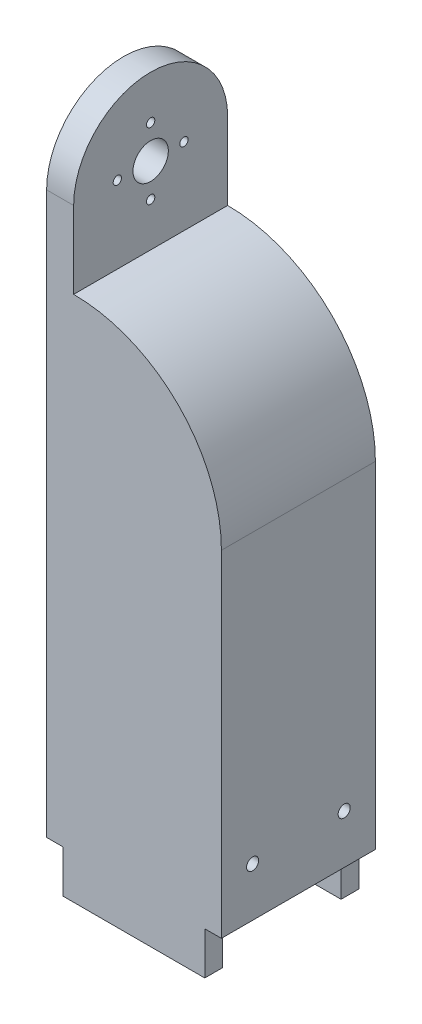
from build123d import *

# Parameters (mm, degrees)
SKETCH1_W               = 50
SKETCH1_H               = 150
BOSS_EXTRUDE1_DEPTH     = 55
CUT_EXTRUDE1_DEPTH      = 168.406690428
CUT_EXTRUDE1_DEPTH_BACK = 45
SKETCH2_R               = 10.25
SKETCH7_R               = 1
SKETCH7_R_2             = 4.25
CUT_EXTRUDE3_DEPTH      = 10
SKETCH8_W               = 55
SKETCH8_H               = 55
SKETCH8_R               = 10.25
BOSS_EXTRUDE2_DEPTH     = 50
SKETCH10_W              = 8
SKETCH10_H              = 10.25
SKETCH10_W_2            = 17
SKETCH10_H_2            = 1
SKETCH10_W_3            = 34
SKETCH10_H_3            = 20
SKETCH10_H_4            = 5
CUT_EXTRUDE4_DEPTH      = 214.717102732
SKETCH11_W              = 34
SKETCH11_H              = 13.25
BOSS_EXTRUDE4_DEPTH     = 25
SKETCH13_W              = 55
SKETCH13_H              = 10
CUT_EXTRUDE5_DEPTH      = 8
SKETCH14_R              = 5.030159043
CUT_EXTRUDE6_DEPTH      = 8
SKETCH15_W              = 34
SKETCH15_H              = 0.25
BOSS_EXTRUDE5_DEPTH     = 13.25
CUT_EXTRUDE7_DEPTH      = 181.416185527
BOSS_EXTRUDE6_START     = 1.5
SKETCH19_R              = 10.25
SKETCH19_R_2            = 1
SKETCH19_R_3            = 4.25
BOSS_EXTRUDE6_DEPTH     = 1.5
CUT_EXTRUDE8_DEPTH      = 184.89467094
SKETCH21_R              = 5.030159043
SKETCH21_R_2            = 4.5
BOSS_EXTRUDE7_DEPTH     = 8
SKETCH24_W              = 4
SKETCH24_H              = 30
CUT_EXTRUDE10_DEPTH     = 181.416185527
SKETCH25_W              = 55
SKETCH25_H              = 86.25
CUT_EXTRUDE11_DEPTH     = 4
BOSS_EXTRUDE8_START     = 4
SKETCH26_R              = 1
SKETCH26_R_2            = 4.25
BOSS_EXTRUDE8_DEPTH     = 4
SKETCH27_W              = 4
SKETCH27_H              = 123.25
CUT_EXTRUDE12_DEPTH     = 181.416185527
CUT_EXTRUDE13_DEPTH     = 180.905530765
SKETCH29_W              = 42
SKETCH29_H              = 9
CUT_EXTRUDE15_DEPTH     = 174.776436838
SKETCH30_R              = 4.5
SKETCH30_R_2            = 1.45
BOSS_EXTRUDE9_DEPTH     = 4


with BuildPart() as part:
    # Sketch1 → Boss-Extrude1 (new body)
    with BuildSketch(Plane.XY):
        with Locations((0, -75)):
            Rectangle(SKETCH1_W, SKETCH1_H)
    extrude(amount=-BOSS_EXTRUDE1_DEPTH)

    # Sketch2 → Cut-Extrude1 (cut, two sides: drawn at the far end of the back side and taken through both)
    with BuildSketch(Plane(origin=(25, 0, 0), x_dir=(0, 0, -1), z_dir=(1, 0, 0)).offset(-CUT_EXTRUDE1_DEPTH_BACK)):
        with Locations(Location((27.5, -25, 0), (0, 0, 270))):
            Circle(SKETCH2_R)
    extrude(amount=CUT_EXTRUDE1_DEPTH + CUT_EXTRUDE1_DEPTH_BACK, mode=Mode.SUBTRACT)

    # Sketch7 → Cut-Extrude3 (cut)
    with BuildSketch(Plane(origin=(-20, 0, 0), x_dir=(0, 0, -1), z_dir=(1, 0, 0))):
        with Locations(Location((27.5, -17, 0), (0, 0, 90))):
            Circle(SKETCH7_R)
        with Locations(Location((35.5, -25, 0), (0, 0, 90))):
            Circle(SKETCH7_R)
        with Locations(Location((27.5, -33, 0), (0, 0, 90))):
            Circle(SKETCH7_R)
        with Locations(Location((19.5, -25, 0), (0, 0, 90))):
            Circle(SKETCH7_R)
        with Locations(Location((27.5, -25, 0), (0, 0, 90))):
            Circle(SKETCH7_R_2)
    extrude(amount=-CUT_EXTRUDE3_DEPTH, mode=Mode.SUBTRACT)

    # Sketch8 → Boss-Extrude2 (add)
    with BuildSketch(Plane(origin=(25, 0, 0), x_dir=(0, 0, -1), z_dir=(1, 0, 0))):
        with Locations((27.5, -177.5)):
            Rectangle(SKETCH8_W, SKETCH8_H)
        with Locations(Location((27.5, -180, 0), (0, 0, 90))):
            Circle(SKETCH8_R, mode=Mode.SUBTRACT)
    extrude(amount=-BOSS_EXTRUDE2_DEPTH)

    # Sketch10 → Cut-Extrude4 (cut, through all)
    with BuildSketch(Plane.XY):
        Polygon((-17, -205), (17, -205), (17, -191.25), (0, -191.25), (-17, -191.25), align=None)
        Polygon((-25, -205), (-17, -205), (-17, -191.25), (-17, -190.25), (-25, -190.25), align=None)
        Polygon((17, -191.25), (17, -205), (25, -205), (25, -190.25), (17, -190.25), align=None)
        with Locations((-21, -185.125)):
            Rectangle(SKETCH10_W, SKETCH10_H)
        with Locations((-21, -174.875)):
            Rectangle(SKETCH10_W, SKETCH10_H)
        with Locations((21, -174.875)):
            Rectangle(SKETCH10_W, SKETCH10_H)
        with Locations((21, -185.125)):
            Rectangle(SKETCH10_W, SKETCH10_H)
        with Locations((-8.5, -185.125)):
            Rectangle(SKETCH10_W_2, SKETCH10_H)
        with Locations((8.5, -185.125)):
            Rectangle(SKETCH10_W_2, SKETCH10_H)
        Polygon((0, -180), (17, -180), (17, -169.75), (-17, -169.75), (-17, -180), align=None)
        with Locations((-8.5, -190.75)):
            Rectangle(SKETCH10_W_2, SKETCH10_H_2)
        with Locations((8.5, -190.75)):
            Rectangle(SKETCH10_W_2, SKETCH10_H_2)
        with Locations((0, -154.75)):
            Rectangle(SKETCH10_W_3, SKETCH10_H_3)
        with Locations((0, -167.25)):
            Rectangle(SKETCH10_W_3, SKETCH10_H_4)
    extrude(amount=-CUT_EXTRUDE4_DEPTH, mode=Mode.SUBTRACT)

    # Sketch11 → Boss-Extrude4 (add)
    with BuildSketch(Plane.XZ.offset(144.75)):
        with Locations((0, -6.625)):
            Rectangle(SKETCH11_W, SKETCH11_H)
        with Locations((0, -48.375)):
            Rectangle(SKETCH11_W, SKETCH11_H)
    extrude(amount=BOSS_EXTRUDE4_DEPTH)

    # Sketch13 → Cut-Extrude5 (cut)
    with BuildSketch(Plane(origin=(25, 0, 0), x_dir=(0, 0, -1), z_dir=(1, 0, 0))):
        with Locations((27.5, -164.75)):
            Rectangle(SKETCH13_W, SKETCH13_H)
    cut_extrude5 = extrude(amount=-CUT_EXTRUDE5_DEPTH, mode=Mode.SUBTRACT)

    # Mirror2: Cut-Extrude5 across plane
    add(cut_extrude5.mirror(Plane(origin=(0, 0, 0), x_dir=(0, 0, 1), z_dir=(1, 0, 0))), mode=Mode.SUBTRACT)

    # Sketch14 → Cut-Extrude6 (cut)
    with BuildSketch(Plane(origin=(25, 0, 0), x_dir=(0, 0, -1), z_dir=(1, 0, 0))):
        with Locations(Location((16.5, -148, 0), (0, 0, 90))):
            Circle(SKETCH14_R)
        with Locations(Location((38.5, -148, 0), (0, 0, 90))):
            Circle(SKETCH14_R)
    cut_extrude6 = extrude(amount=-CUT_EXTRUDE6_DEPTH, mode=Mode.SUBTRACT)

    # Mirror3: Cut-Extrude6 across plane
    add(cut_extrude6.mirror(Plane(origin=(0, 0, 0), x_dir=(0, 0, 1), z_dir=(1, 0, 0))), mode=Mode.SUBTRACT)

    # Sketch15 → Boss-Extrude5 (add)
    with BuildSketch(Plane.XY):
        with Locations((0, -169.875)):
            Rectangle(SKETCH15_W, SKETCH15_H)
    boss_extrude5 = extrude(amount=-BOSS_EXTRUDE5_DEPTH)

    # Mirror4: Boss-Extrude5 across plane
    add(boss_extrude5.mirror(Plane.XY.offset(-27.5)))

    # Sketch16 → Cut-Extrude7 (cut, through all)
    with BuildSketch(Plane.XY):
        Polygon((-18.5, 0), (-18.5, -14.75), (-18.5, -35.25), (-18.5, -43.5), (25, -43.5), (25, 0), align=None)
    extrude(amount=-CUT_EXTRUDE7_DEPTH, mode=Mode.SUBTRACT)

    # Sketch19 → Boss-Extrude6 (add)
    with BuildSketch(Plane(origin=(-20, 0, 0), x_dir=(0, 0, -1), z_dir=(1, 0, 0)).offset(BOSS_EXTRUDE6_START)):
        with Locations((27.5, -25)):
            Circle(SKETCH19_R)
        with Locations(Location((27.5, -17, 0), (0, 0, 90))):
            Circle(SKETCH19_R_2, mode=Mode.SUBTRACT)
        with Locations(Location((27.5, -33, 0), (0, 0, 90))):
            Circle(SKETCH19_R_2, mode=Mode.SUBTRACT)
        with Locations(Location((19.5, -25, 0), (0, 0, 90))):
            Circle(SKETCH19_R_2, mode=Mode.SUBTRACT)
        with Locations(Location((35.5, -25, 0), (0, 0, 90))):
            Circle(SKETCH19_R_2, mode=Mode.SUBTRACT)
        with Locations(Location((27.5, -25, 0), (0, 0, 90))):
            Circle(SKETCH19_R_3, mode=Mode.SUBTRACT)
    extrude(amount=-BOSS_EXTRUDE6_DEPTH)

    # Sketch20 → Cut-Extrude8 (cut, through all)
    with BuildSketch(Plane(origin=(-18.5, 0, 0), x_dir=(0, 0, -1), z_dir=(1, 0, 0))):
        with BuildLine():
            Line((0, 0), (0, -43.5))
            Line((0, -43.5), (9, -43.5))
            Line((9, -43.5), (9, -25))
            ThreePointArc((9, -25), (27.5, -6.5), (46, -25))
            Line((46, -25), (46, -43.5))
            Line((46, -43.5), (55, -43.5))
            Line((55, -43.5), (55, 0))
            Line((55, 0), (0, 0))
        make_face()
    extrude(amount=-CUT_EXTRUDE8_DEPTH, mode=Mode.SUBTRACT)

    # Sketch21 → Boss-Extrude7 (add)
    # profile 1 of 2: a face of its own
    with BuildSketch(Plane(origin=(25, 0, 0), x_dir=(0, 0, -1), z_dir=(1, 0, 0))):
        with Locations(Location((16.5, -148, 0), (0, 0, 229.751587581))):
            Circle(SKETCH21_R)
        with Locations(Location((16.5, -148, 0), (0, 0, 90))):
            Circle(SKETCH21_R_2, mode=Mode.SUBTRACT)
    # profile 2 of 2: a face of its own
    with BuildSketch(Plane(origin=(25, 0, 0), x_dir=(0, 0, -1), z_dir=(1, 0, 0))):
        with Locations(Location((38.5, -148, 0), (0, 0, 310.248412419))):
            Circle(SKETCH21_R)
        with Locations(Location((38.5, -148, 0), (0, 0, 90))):
            Circle(SKETCH21_R_2, mode=Mode.SUBTRACT)
    boss_extrude7 = extrude(amount=-BOSS_EXTRUDE7_DEPTH)

    # Mirror5: Boss-Extrude7 across plane
    add(boss_extrude7.mirror(Plane(origin=(0, 0, 0), x_dir=(0, 0, 1), z_dir=(1, 0, 0))))

    # Sketch24 → Cut-Extrude10 (cut, through all)
    with BuildSketch(Plane.XY):
        with Locations((-23, -144.75)):
            Rectangle(SKETCH24_W, SKETCH24_H)
        with Locations((23, -144.75)):
            Rectangle(SKETCH24_W, SKETCH24_H)
    extrude(amount=-CUT_EXTRUDE10_DEPTH, mode=Mode.SUBTRACT)

    # Sketch25 → Cut-Extrude11 (cut)
    with BuildSketch(Plane(origin=(25, 0, 0), x_dir=(0, 0, -1), z_dir=(1, 0, 0))):
        with Locations((27.5, -86.625)):
            Rectangle(SKETCH25_W, SKETCH25_H)
    extrude(amount=-CUT_EXTRUDE11_DEPTH, mode=Mode.SUBTRACT)

    # Sketch26 → Boss-Extrude8 (add)
    with BuildSketch(Plane(origin=(-18.5, 0, 0), x_dir=(0, 0, -1), z_dir=(1, 0, 0)).offset(BOSS_EXTRUDE8_START)):
        with BuildLine():
            Line((46, -43.5), (46, -25))
            ThreePointArc((46, -25), (27.5, -6.5), (9, -25))
            Line((9, -25), (9, -43.5))
            Line((9, -43.5), (46, -43.5))
        make_face()
        with Locations(Location((35.5, -25, 0), (0, 0, 90))):
            Circle(SKETCH26_R, mode=Mode.SUBTRACT)
        with Locations(Location((27.5, -25, 0), (0, 0, 90))):
            Circle(SKETCH26_R_2, mode=Mode.SUBTRACT)
        with Locations(Location((19.5, -25, 0), (0, 0, 90))):
            Circle(SKETCH26_R, mode=Mode.SUBTRACT)
        with Locations(Location((27.5, -33, 0), (0, 0, 90))):
            Circle(SKETCH26_R, mode=Mode.SUBTRACT)
        with Locations(Location((27.5, -17, 0), (0, 0, 90))):
            Circle(SKETCH26_R, mode=Mode.SUBTRACT)
    extrude(amount=-BOSS_EXTRUDE8_DEPTH)

    # Sketch27 → Cut-Extrude12 (cut, through all)
    with BuildSketch(Plane.XY):
        with Locations((-23, -68.125)):
            Rectangle(SKETCH27_W, SKETCH27_H)
    extrude(amount=-CUT_EXTRUDE12_DEPTH, mode=Mode.SUBTRACT)

    # Sketch28 → Cut-Extrude13 (cut, through all)
    with BuildSketch(Plane.XY):
        with BuildLine():
            Line((21, -43.5), (-14.5, -43.5))
            ThreePointArc((-14.5, -43.5), (10.602290732, -53.897709268), (21, -79))
            Line((21, -79), (21, -43.5))
        make_face()
    extrude(amount=-CUT_EXTRUDE13_DEPTH, mode=Mode.SUBTRACT)

    # Sketch29 → Cut-Extrude15 (cut, through all)
    with BuildSketch(Plane.XZ.offset(170)):
        with Locations((0, -50.5)):
            Rectangle(SKETCH29_W, SKETCH29_H)
        with Locations((0, -4.5)):
            Rectangle(SKETCH29_W, SKETCH29_H)
    extrude(amount=-CUT_EXTRUDE15_DEPTH, mode=Mode.SUBTRACT)

    # Sketch30 → Boss-Extrude9 (add)
    # profile 1 of 2: a face of its own
    with BuildSketch(Plane(origin=(21, 0, 0), x_dir=(0, 0, -1), z_dir=(1, 0, 0))):
        with Locations(Location((16.5, -148, 0), (0, 0, 223.761742693))):
            Circle(SKETCH30_R)
        with Locations((16.5, -148)):
            Circle(SKETCH30_R_2, mode=Mode.SUBTRACT)
    # profile 2 of 2: a face of its own
    with BuildSketch(Plane(origin=(21, 0, 0), x_dir=(0, 0, -1), z_dir=(1, 0, 0))):
        with Locations(Location((38.5, -148, 0), (0, 0, 316.238257307))):
            Circle(SKETCH30_R)
        with Locations((38.5, -148)):
            Circle(SKETCH30_R_2, mode=Mode.SUBTRACT)
    boss_extrude9 = extrude(amount=-BOSS_EXTRUDE9_DEPTH)

    # Mirror6: Boss-Extrude9 across plane
    add(boss_extrude9.mirror(Plane(origin=(0, 0, 0), x_dir=(0, 0, 1), z_dir=(1, 0, 0))))


solid = part.part
